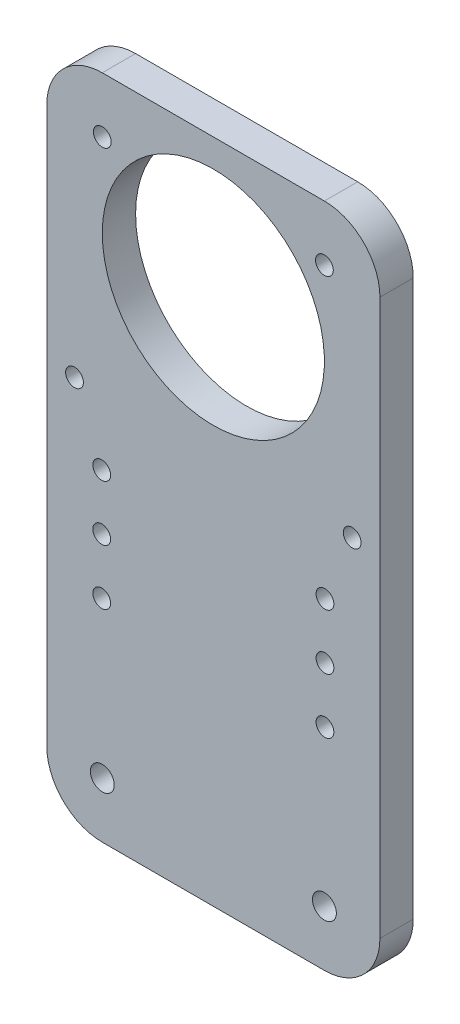
from build123d import *

# Parameters (mm, degrees)
SKETCH_1_W          = 60
SKETCH_1_H          = 120
SKETCH_1_R          = 1.6
SKETCH_1_R_2        = 2.15
EXTRUDE_3_DEPTH     = 6
SKETCH_9_R          = 1.6
CUT_EXTRUDE_1_DEPTH = 6
FILLET_1_R          = 10
SKETCH_11_R         = 20
SKETCH_11_R_2       = 1.6
CUT_EXTRUDE_2_DEPTH = 6
SKETCH_21_R         = 1.6
CUT_EXTRUDE_7_DEPTH = 10


with BuildPart() as part:
    # 草图1 → 凸台-拉伸3 (new body)
    with BuildSketch(Plane.XY):
        Rectangle(SKETCH_1_W, SKETCH_1_H)
        with Locations((0, 50.5)):
            Circle(SKETCH_1_R, mode=Mode.SUBTRACT)
        with Locations((20, -50)):
            Circle(SKETCH_1_R_2, mode=Mode.SUBTRACT)
        with Locations((-20, -50)):
            Circle(SKETCH_1_R_2, mode=Mode.SUBTRACT)
        with Locations((13.423393759, 42.75)):
            Circle(SKETCH_1_R, mode=Mode.SUBTRACT)
        with Locations((13.423393759, 27.25)):
            Circle(SKETCH_1_R, mode=Mode.SUBTRACT)
        with Locations((0, 19.5)):
            Circle(SKETCH_1_R, mode=Mode.SUBTRACT)
        with Locations((-13.423393759, 27.25)):
            Circle(SKETCH_1_R, mode=Mode.SUBTRACT)
        with Locations((-13.423393759, 42.75)):
            Circle(SKETCH_1_R, mode=Mode.SUBTRACT)
        with BuildLine():
            Line((6, 42), (6, 28))
            ThreePointArc((6, 28), (0, 22), (-6, 28))
            Line((-6, 28), (-6, 42))
            ThreePointArc((-6, 42), (0, 48), (6, 42))
        make_face(mode=Mode.SUBTRACT)
    extrude(amount=EXTRUDE_3_DEPTH)

    # 草图9 → 切除-拉伸1 (cut)
    with BuildSketch(Plane.XY.offset(6)):
        with Locations((20.1, -22)):
            Circle(SKETCH_9_R)
        with Locations((20.1, -2)):
            Circle(SKETCH_9_R)
        with Locations((20.1, -12)):
            Circle(SKETCH_9_R)
        with Locations((-20.1, -2)):
            Circle(SKETCH_9_R)
        with Locations((-20.1, -12)):
            Circle(SKETCH_9_R)
        with Locations((-20.1, -22)):
            Circle(SKETCH_9_R)
    extrude(amount=-CUT_EXTRUDE_1_DEPTH, mode=Mode.SUBTRACT)

    # 圆角1
    fillet_1_edges = [part.edges().sort_by_distance(p)[0] for p in [
        (30, -60, 3),
        (-30, -60, 3),
        (-30, 60, 3),
        (30, 60, 3),
    ]]
    fillet(fillet_1_edges, radius=FILLET_1_R)

    # 草图11 → 切除-拉伸2 (cut)
    with BuildSketch(Plane(origin=(0, 0, 0), x_dir=(-1, 0, 0), z_dir=(0, 0, -1))):
        with Locations((0, 35)):
            Circle(SKETCH_11_R)
        with Locations((-13.423393759, 27.25)):
            Circle(SKETCH_11_R_2, mode=Mode.SUBTRACT)
        with Locations((13.423393759, 27.25)):
            Circle(SKETCH_11_R_2, mode=Mode.SUBTRACT)
        with Locations((13.423393759, 42.75)):
            Circle(SKETCH_11_R_2, mode=Mode.SUBTRACT)
        with Locations((0, 19.5)):
            Circle(SKETCH_11_R_2, mode=Mode.SUBTRACT)
        with Locations((0, 50.5)):
            Circle(SKETCH_11_R_2, mode=Mode.SUBTRACT)
        with Locations((-13.423393759, 42.75)):
            Circle(SKETCH_11_R_2, mode=Mode.SUBTRACT)
        with BuildLine():
            ThreePointArc((-6, 42), (0, 48), (6, 42))
            Line((6, 42), (6, 28))
            ThreePointArc((6, 28), (0, 22), (-6, 28))
            Line((-6, 28), (-6, 42))
        make_face(mode=Mode.SUBTRACT)
    extrude(amount=-CUT_EXTRUDE_2_DEPTH, mode=Mode.SUBTRACT)

    # 草图21 → 切除-拉伸7 (cut)
    with BuildSketch(Plane(origin=(0, 0, 0), x_dir=(-1, 0, 0), z_dir=(0, 0, -1))):
        with Locations((-20, 50)):
            Circle(SKETCH_21_R)
        with Locations(Location((20, 50, 0), (0, 0, 180))):
            Circle(SKETCH_21_R)
        with Locations((25, 10)):
            Circle(SKETCH_21_R)
        with Locations(Location((-25, 10, 0), (0, 0, 180))):
            Circle(SKETCH_21_R)
    extrude(amount=-CUT_EXTRUDE_7_DEPTH, mode=Mode.SUBTRACT)


solid = part.part
